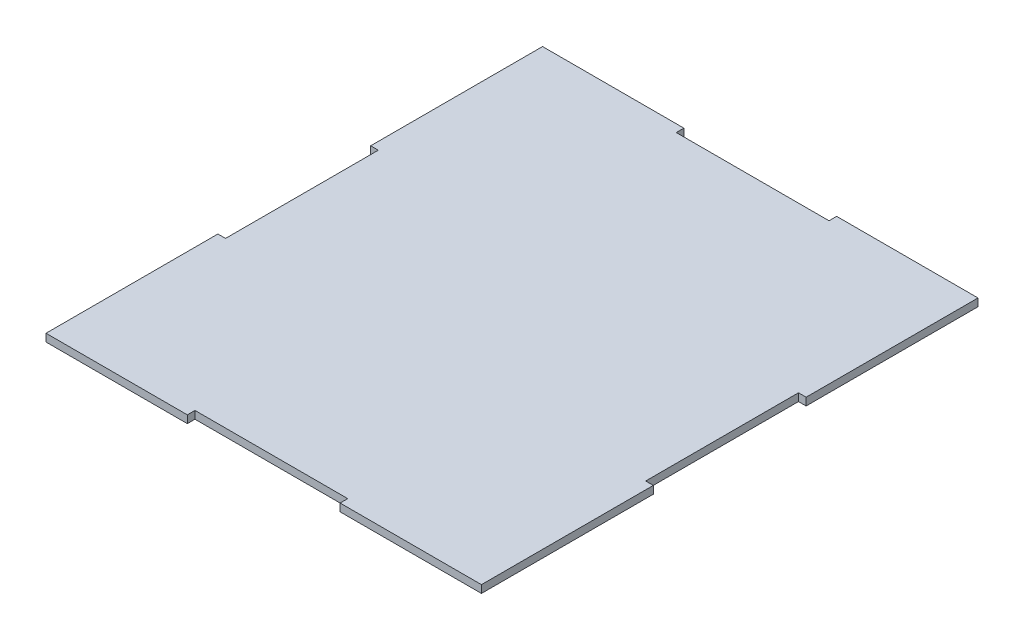
from build123d import *

# Parameters (mm, degrees)
SKIZZE1_W                       = 285
SKIZZE1_H                       = 325
AUFSATZ_LINEAR_AUSTRAGEN1_DEPTH = 5
SKIZZE2_W                       = 5
SKIZZE2_H                       = 100
SCHNITT_LINEAR_AUSTRAGEN1_DEPTH = 433.290411645


with BuildPart() as part:
    # Skizze1 → Aufsatz-Linear austragen1 (new body)
    with BuildSketch(Plane(origin=(0, 0, 0), x_dir=(1, 0, 0), z_dir=(0, 1, 0))):
        with Locations((142.5, 162.5)):
            Rectangle(SKIZZE1_W, SKIZZE1_H)
    extrude(amount=AUFSATZ_LINEAR_AUSTRAGEN1_DEPTH)

    # Skizze2 → Schnitt-Linear austragen1 (cut, through all)
    with BuildSketch(Plane(origin=(0, 5, 0), x_dir=(1, 0, 0), z_dir=(0, 1, 0))):
        Polygon((142.5, 325), (92.5, 325), (92.5, 320), (192.5, 320), (192.5, 325), align=None)
        with Locations((2.5, 162.5)):
            Rectangle(SKIZZE2_W, SKIZZE2_H)
        with Locations((282.5, 162.5)):
            Rectangle(SKIZZE2_W, SKIZZE2_H)
        Polygon((142.5, 0), (192.5, 0), (192.5, 5), (92.5, 5), (92.5, 0), align=None)
    extrude(amount=-SCHNITT_LINEAR_AUSTRAGEN1_DEPTH, mode=Mode.SUBTRACT)


solid = part.part
